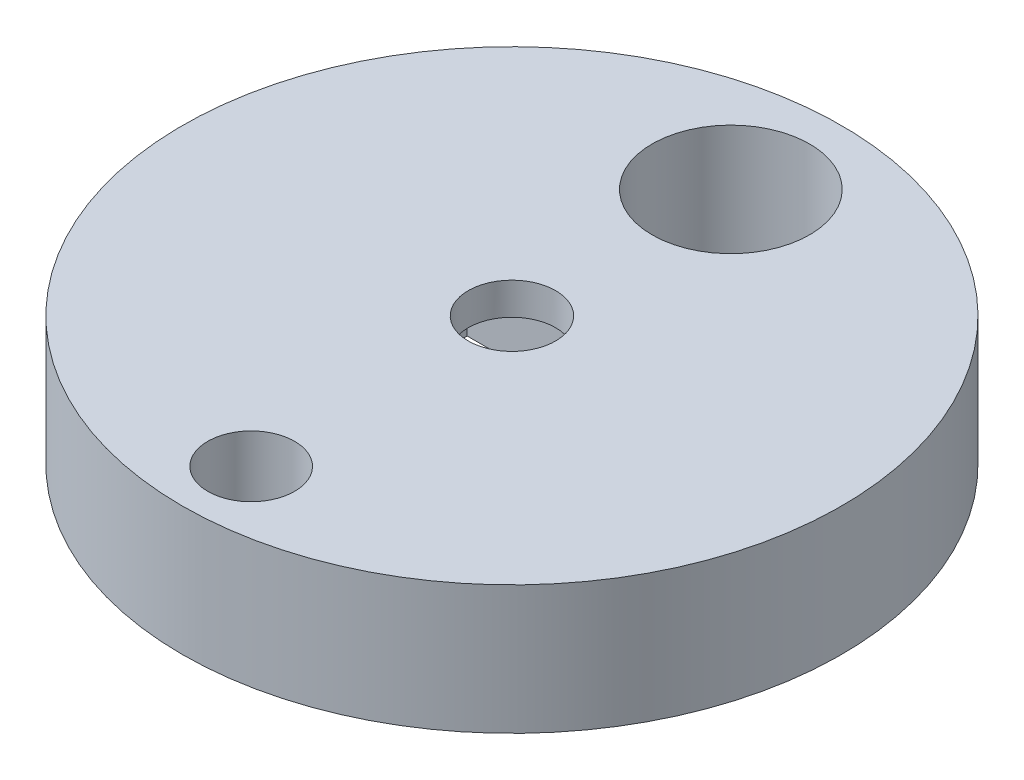
from build123d import *

# Parameters (mm, degrees)
SKETCH1_R           = 26.035
BOSS_EXTRUDE1_DEPTH = 10.16
SKETCH2_R           = 6.223
SKETCH2_R_2         = 3.429
SKETCH2_R_3         = 3.45
CUT_EXTRUDE1_DEPTH  = 39.195131234
SKETCH3_W           = 21.082
SKETCH3_H           = 18.542
CUT_EXTRUDE2_DEPTH  = 7.62


with BuildPart() as part:
    # Sketch1 → Boss-Extrude1 (new body)
    with BuildSketch(Plane(origin=(0, 0, 0), x_dir=(1, 0, 0), z_dir=(0, 1, 0))):
        with Locations(Location((0, 0, 0), (0, 0, 270))):
            Circle(SKETCH1_R)
    extrude(amount=BOSS_EXTRUDE1_DEPTH)

    # Sketch2 → Cut-Extrude1 (cut, through all)
    with BuildSketch(Plane(origin=(0, 10.16, 0), x_dir=(1, 0, 0), z_dir=(0, 1, 0))):
        with Locations(Location((0, 17.293004752, 0), (0, 0, 270))):
            Circle(SKETCH2_R)
        with Locations(Location((0, -20.598576002, 0), (0, 0, 270))):
            Circle(SKETCH2_R_2)
        with Locations(Location((0, 0, 0), (0, 0, 270))):
            Circle(SKETCH2_R_3)
    extrude(amount=-CUT_EXTRUDE1_DEPTH, mode=Mode.SUBTRACT)

    # Sketch3 → Cut-Extrude2 (cut)
    with BuildSketch(Plane.XZ):
        with Locations((0, 2.265)):
            Rectangle(SKETCH3_W, SKETCH3_H)
    extrude(amount=-CUT_EXTRUDE2_DEPTH, mode=Mode.SUBTRACT)


solid = part.part
